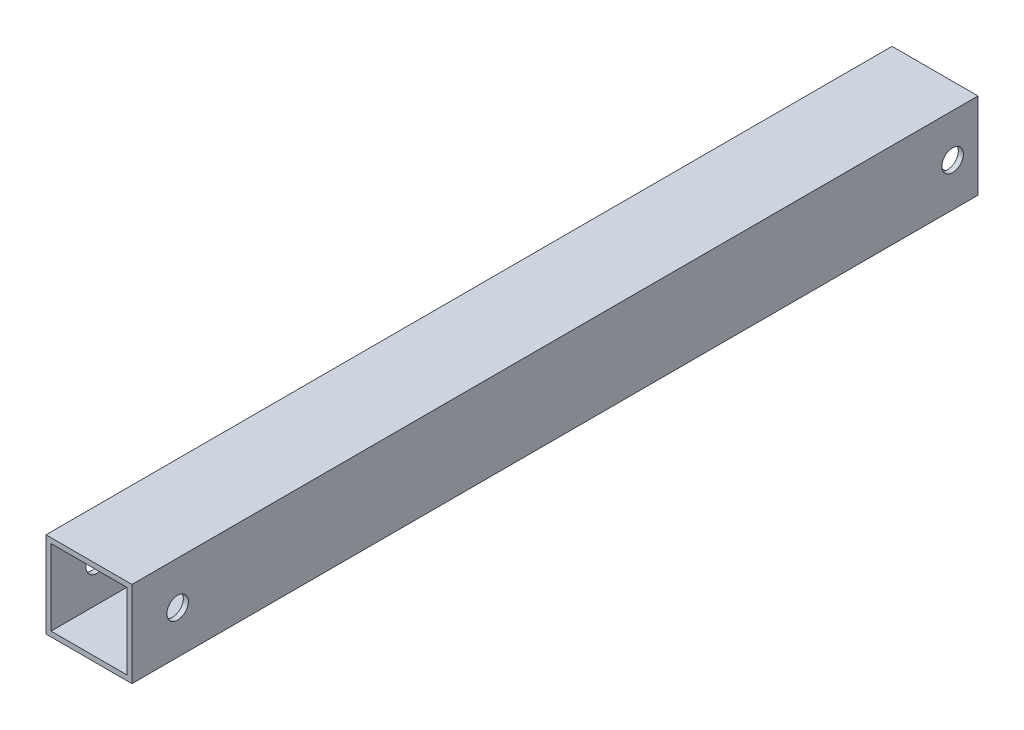
from build123d import *

# Parameters (mm, degrees)
CROQUIS1_W              = 50.8
CROQUIS1_H              = 50.8
CROQUIS1_W_2            = 44.8
CROQUIS1_H_2            = 44.8
SALIENTE_EXTRUIR1_DEPTH = 250
CROQUIS2_R              = 6.35
CORTAR_EXTRUIR1_DEPTH   = 257.370435113


with BuildPart() as part:
    # Croquis1 → Saliente-Extruir1 (new, symmetric)
    with BuildSketch(Plane.XY):
        Rectangle(CROQUIS1_W, CROQUIS1_H)
        Rectangle(CROQUIS1_W_2, CROQUIS1_H_2, mode=Mode.SUBTRACT)
    extrude(amount=SALIENTE_EXTRUIR1_DEPTH, both=True)

    # Croquis2 → Cortar-Extruir1 (cut, through all)
    with BuildSketch(Plane(origin=(25.4, 0, 0), x_dir=(0, 0, -1), z_dir=(1, 0, 0))):
        with Locations((-223, 0)):
            Circle(CROQUIS2_R)
        with Locations(Location((235, 0, 0), (0, 0, 270))):
            Circle(CROQUIS2_R)
    extrude(amount=-CORTAR_EXTRUIR1_DEPTH, mode=Mode.SUBTRACT)


solid = part.part
